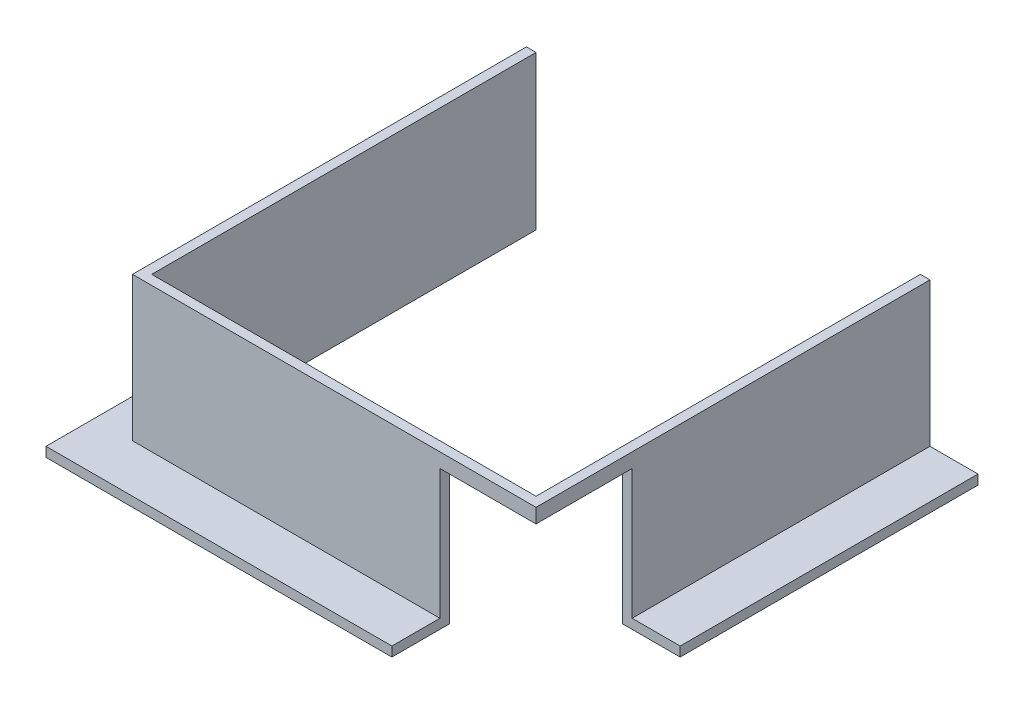
from build123d import *

# Parameters (mm, degrees)
BOSS_EXTRUDE1_DEPTH = 30
SKETCH2_W           = 20
SKETCH2_H           = 20
CUT_EXTRUDE1_DEPTH  = 20
BOSS_EXTRUDE2_DEPTH = 2
SKETCH4_W           = 30
SKETCH4_H           = 2
CUT_EXTRUDE2_DEPTH  = 30
SKETCH5_W           = 20
SKETCH5_H           = 7
CUT_EXTRUDE3_DEPTH  = 20


with BuildPart() as part:
    # Sketch1 → Boss-Extrude1 (new body)
    with BuildSketch(Plane(origin=(0, 0, 0), x_dir=(1, 0, 0), z_dir=(0, 1, 0))):
        Polygon((0, 0), (80, 0), (80, 80), (82, 80), (82, -2), (80, -2), (-2, -2), (-2, 80), (0, 80), align=None)
    extrude(amount=BOSS_EXTRUDE1_DEPTH)

    # Sketch2 → Cut-Extrude1 (cut)
    with BuildSketch(Plane(origin=(82, 0, 0), x_dir=(0, 0, -1), z_dir=(1, 0, 0))):
        with Locations((8, 10)):
            Rectangle(SKETCH2_W, SKETCH2_H)
    extrude(amount=-CUT_EXTRUDE1_DEPTH, mode=Mode.SUBTRACT)

    # Sketch3 → Boss-Extrude2 (add)
    with BuildSketch(Plane.XZ):
        Polygon((0, -80), (-10, -80), (-10, 7.412942582), (-10, 12), (92, 12), (92, 2), (92, -80), (80, -80), (80, 0), (0, 0), align=None)
    extrude(amount=BOSS_EXTRUDE2_DEPTH)

    # Sketch4 → Cut-Extrude2 (cut)
    with BuildSketch(Plane(origin=(92, 0, 0), x_dir=(0, 0, -1), z_dir=(1, 0, 0))):
        with Locations((3, -1)):
            Rectangle(SKETCH4_W, SKETCH4_H)
    extrude(amount=-CUT_EXTRUDE2_DEPTH, mode=Mode.SUBTRACT)

    # Sketch5 → Cut-Extrude3 (cut)
    with BuildSketch(Plane(origin=(82, 0, 0), x_dir=(0, 0, -1), z_dir=(1, 0, 0))):
        with Locations((8, 23.5)):
            Rectangle(SKETCH5_W, SKETCH5_H)
    extrude(amount=-CUT_EXTRUDE3_DEPTH, mode=Mode.SUBTRACT)


solid = part.part
